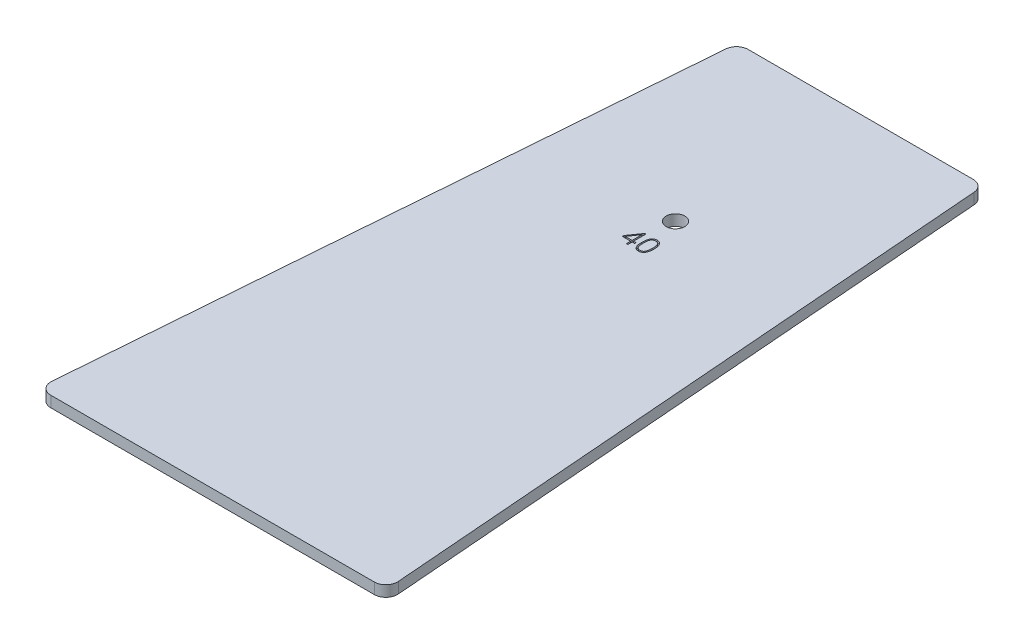
from build123d import *

# Parameters (mm, degrees)
BOSS_EXTRUDE1_DEPTH = 5.9944
SKETCH2_R           = 5.08
CUT_EXTRUDE1_DEPTH  = 369.278830147
CUT_EXTRUDE2_DEPTH  = 1.27
FILLET1_R           = 6.35


with BuildPart() as part:
    # Sketch1 → Boss-Extrude1 (new body)
    with BuildSketch(Plane(origin=(0, 0, 0), x_dir=(1, 0, 0), z_dir=(0, 1, 0))):
        Polygon((-67.6275, 0), (67.6275, 0), (95.613826947, -355.6), (-95.613826947, -355.6), align=None)
    extrude(amount=BOSS_EXTRUDE1_DEPTH)

    # Sketch2 → Cut-Extrude1 (cut, through all)
    with BuildSketch(Plane(origin=(0, 5.9944, 0), x_dir=(1, 0, 0), z_dir=(0, 1, 0))):
        with Locations(Location((0, -101.6, 0), (0, 0, 270))):
            Circle(SKETCH2_R)
    extrude(amount=-CUT_EXTRUDE1_DEPTH, mode=Mode.SUBTRACT)

    # Sketch3 → Cut-Extrude2 (cut)
    # profile 1 of 2: a face of its own
    with BuildSketch(Plane(origin=(0, 5.9944, 0), x_dir=(1, 0, 0), z_dir=(0, 1, 0))):
        Polygon((-0.64745098, -123.339411765), (-2.041960784, -123.339411765), (-2.041960784, -125.73), (-2.838823529, -125.73), (-2.838823529, -123.339411765), (-7.420784314, -123.339411765), (-7.420784314, -122.54254902), (-2.676960784, -115.769215686), (-2.041960784, -115.769215686), (-2.041960784, -122.54254902), (-0.64745098, -122.54254902), align=None)
        Polygon((-2.838823529, -122.54254902), (-2.838823529, -117.185514706), (-6.589681373, -122.54254902), align=None, mode=Mode.SUBTRACT)
    # profile 2 of 2: a face of its own
    with BuildSketch(Plane(origin=(0, 5.9944, 0), x_dir=(1, 0, 0), z_dir=(0, 1, 0))):
        with BuildLine():
            add(Edge.make_bspline(
                [(7.321176471, -120.755833333), (7.318828398, -120.964435203), (7.314268428, -121.369541156), (7.278053355, -121.956745016), (7.212590307, -122.503235643), (7.123658685, -123.008755237), (7.008266172, -123.474678786), (6.871087333, -123.902056716), (6.702092819, -124.287425995), (6.508215245, -124.632617465), (6.291747836, -124.939879658), (6.045192851, -125.205053414), (5.774903263, -125.430333986), (5.47658793, -125.612983557), (5.154255704, -125.75891836), (4.803074469, -125.854617169), (4.428855706, -125.921386338), (4.17035965, -125.926554175), (4.037230392, -125.929215686)],
                knots=[0, 0, 0, 0, 1.444951835, 2.806104229, 4.07292158, 5.255788138, 6.359234241, 7.395665143, 8.361159583, 9.268708362, 10.134304339, 10.95819393, 11.769860228, 12.563733626, 13.374508403, 14.211708464, 15.079003648, 16, 16, 16, 16], degree=3))
            add(Edge.make_bspline(
                [(4.037230392, -125.929215686), (3.904173743, -125.926129436), (3.644961099, -125.920116997), (3.27017657, -125.859085315), (2.920411161, -125.763594373), (2.59640029, -125.625895969), (2.300139806, -125.446021212), (2.024069589, -125.233082993), (1.778627689, -124.975727427), (1.560171839, -124.679785297), (1.365195047, -124.347714828), (1.20253453, -123.973246068), (1.058366082, -123.562916679), (0.945634561, -123.112374896), (0.854092493, -122.625055928), (0.795691583, -122.097466824), (0.752427723, -121.531621273), (0.748884772, -121.140869167), (0.747058824, -120.939485294)],
                knots=[0, 0, 0, 0, 0.942187573, 1.835510922, 2.682899358, 3.50644207, 4.321041037, 5.132947656, 5.970162763, 6.831912057, 7.734836617, 8.692673853, 9.720484412, 10.813675431, 11.980358204, 13.231647047, 14.573260056, 16, 16, 16, 16], degree=3))
            add(Edge.make_bspline(
                [(0.747058824, -120.939485294), (0.749189738, -120.709081181), (0.753301018, -120.264550974), (0.791785956, -119.623892076), (0.848921011, -119.033607435), (0.931327178, -118.493626742), (1.041809864, -118.002956136), (1.18209133, -117.562748274), (1.344352733, -117.168906906), (1.542969603, -116.826611164), (1.76640963, -116.527719309), (2.011736134, -116.265404707), (2.288722816, -116.05041743), (2.588716504, -115.873144616), (2.914180915, -115.735469097), (3.266151279, -115.640569114), (3.642854433, -115.578856283), (3.90312556, -115.573011518), (4.037230392, -115.57)],
                knots=[0, 0, 0, 0, 1.545108237, 2.981054794, 4.302900454, 5.52134946, 6.64223763, 7.672189641, 8.617001291, 9.493094031, 10.318410963, 11.115795503, 11.893970542, 12.661367534, 13.447190288, 14.255881535, 15.101342067, 16, 16, 16, 16], degree=3))
            add(Edge.make_bspline(
                [(4.037230392, -115.57), (4.170238627, -115.57448963), (4.428282356, -115.583199774), (4.804192318, -115.642018007), (5.152618043, -115.745772402), (5.478653289, -115.884356647), (5.772542755, -116.073295118), (6.047681503, -116.293496105), (6.289327541, -116.562467111), (6.510315761, -116.867199073), (6.701841879, -117.215226558), (6.869820244, -117.601739646), (7.009467972, -118.029371708), (7.123413066, -118.496780378), (7.21266615, -119.005311375), (7.277684225, -119.552884468), (7.314472673, -120.141074122), (7.318890361, -120.546189931), (7.321176471, -120.755833333)],
                knots=[0, 0, 0, 0, 0.919968977, 1.784793451, 2.622728724, 3.429378823, 4.225844794, 5.031728358, 5.85964663, 6.718105312, 7.630541726, 8.601153045, 9.629202519, 10.737948011, 11.926092541, 13.198121829, 14.550055913, 16, 16, 16, 16], degree=3))
        make_face()
        with BuildLine():
            add(Edge.make_bspline(
                [(6.524313725, -120.768284314), (6.522566947, -120.59082563), (6.519183425, -120.247086842), (6.491882586, -119.747351272), (6.442379883, -119.282006526), (6.374689104, -118.850591154), (6.287787289, -118.454473729), (6.184085269, -118.091152232), (6.054789642, -117.764549081), (5.914753741, -117.468482457), (5.746577036, -117.21145005), (5.563889756, -116.983709924), (5.356631682, -116.79434266), (5.134096525, -116.633668508), (4.887159424, -116.51702345), (4.624573174, -116.42744118), (4.339914631, -116.378499272), (4.144272117, -116.370819959), (4.043455882, -116.366862745)],
                knots=[0, 0, 0, 0, 1.502278276, 2.909924168, 4.234983773, 5.462469173, 6.604815465, 7.666614396, 8.656743616, 9.57599474, 10.43362925, 11.251287335, 12.040715275, 12.803499886, 13.565626727, 14.343386511, 15.146333119, 16, 16, 16, 16], degree=3))
            add(Edge.make_bspline(
                [(4.043455882, -116.366862745), (3.938447052, -116.369409337), (3.734422845, -116.374357173), (3.43835687, -116.425549656), (3.163244621, -116.509328168), (2.90892764, -116.62546025), (2.673837753, -116.772323146), (2.465862577, -116.959962497), (2.272440236, -117.175944485), (2.105615234, -117.430931462), (1.958401995, -117.71853329), (1.838162718, -118.042916058), (1.738143905, -118.401926091), (1.665875136, -118.800267442), (1.610637384, -119.239896883), (1.570198504, -119.724849093), (1.550557152, -120.257632824), (1.546194025, -120.628198528), (1.543921569, -120.82120098)],
                knots=[0, 0, 0, 0, 0.869467109, 1.689308758, 2.480750345, 3.246411928, 4.000153033, 4.767743238, 5.559605047, 6.396624794, 7.284891774, 8.231849658, 9.258192498, 10.369472511, 11.583108734, 12.929054675, 14.400553601, 16, 16, 16, 16], degree=3))
            add(Edge.make_bspline(
                [(1.543921569, -120.82120098), (1.544614632, -120.988289367), (1.54595406, -121.311207558), (1.570315432, -121.778131708), (1.598441181, -122.210377927), (1.645028029, -122.609499828), (1.709082826, -122.979104893), (1.796740701, -123.322117953), (1.902442711, -123.64204798), (2.027679077, -123.937897338), (2.18133626, -124.206925847), (2.364747317, -124.444835267), (2.580966733, -124.649942715), (2.82339308, -124.825742486), (3.097933318, -124.96336255), (3.398653863, -125.062824592), (3.726651153, -125.123356927), (3.95395607, -125.129287098), (4.071470588, -125.132352941)],
                knots=[0, 0, 0, 0, 1.411809826, 2.728490499, 3.95043818, 5.071756233, 6.122676174, 7.117949067, 8.060697316, 8.967954545, 9.828234386, 10.671864258, 11.496693245, 12.338635446, 13.193491276, 14.080783746, 15.007783125, 16, 16, 16, 16], degree=3))
            add(Edge.make_bspline(
                [(4.071470588, -125.132352941), (4.170329033, -125.130072963), (4.364367231, -125.125597848), (4.644218388, -125.069712213), (4.907756322, -124.987576413), (5.148049832, -124.862984482), (5.372323269, -124.710857365), (5.572547405, -124.519087844), (5.758725654, -124.297778208), (5.918122592, -124.036648789), (6.062406119, -123.745178799), (6.186127809, -123.4196766), (6.291039197, -123.06045838), (6.37874373, -122.667596662), (6.4407328, -122.240695517), (6.492645246, -121.781020892), (6.51900758, -121.286348012), (6.522506852, -120.944697746), (6.524313725, -120.768284314)],
                knots=[0, 0, 0, 0, 0.843506666, 1.655625022, 2.429524786, 3.194843558, 3.95975131, 4.737602927, 5.556133668, 6.424576934, 7.344541811, 8.332537572, 9.395844817, 10.540307741, 11.769239909, 13.080349428, 14.492418622, 16, 16, 16, 16], degree=3))
        make_face(mode=Mode.SUBTRACT)
    extrude(amount=-CUT_EXTRUDE2_DEPTH, mode=Mode.SUBTRACT)

    # Fillet1
    fillet1_edges = [part.edges().sort_by_distance(p)[0] for p in [
        (95.613826947, 2.9972, 355.6),
        (-95.613826947, 2.9972, 355.6),
        (-67.6275, 2.9972, 0),
        (67.6275, 2.9972, 0),
    ]]
    fillet(fillet1_edges, radius=FILLET1_R)


solid = part.part
